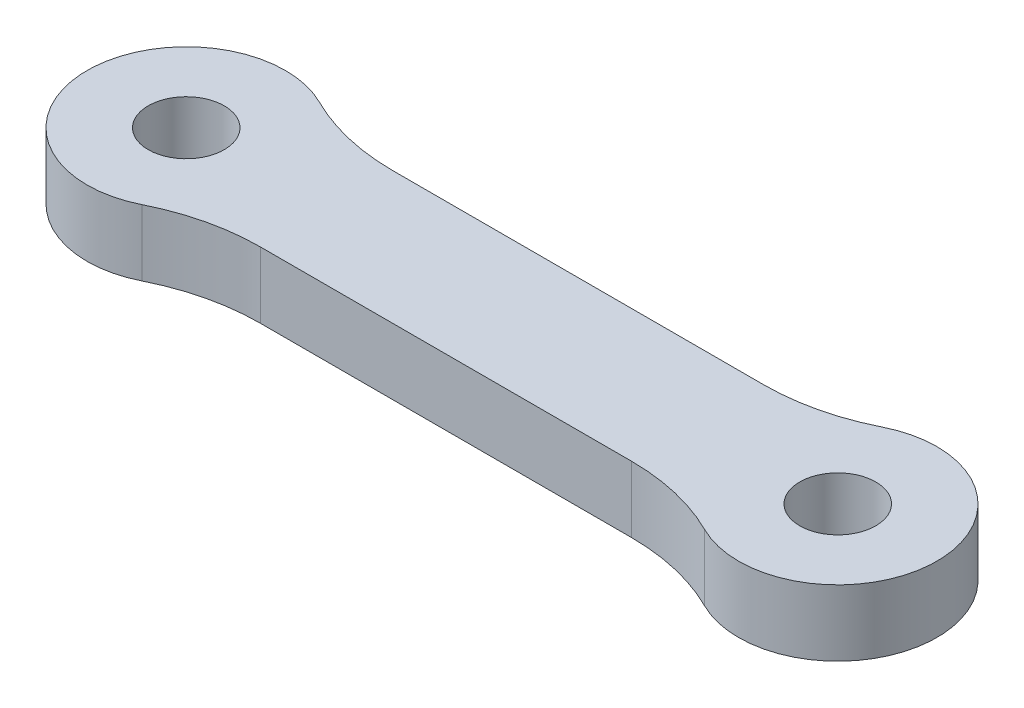
from build123d import *

# Parameters (mm, degrees)
SKETCH_1_R      = 1.15
EXTRUDE_1_DEPTH = 2
FILLET_1_R      = 6.5


with BuildPart() as part:
    # Эскиз1 → Бобышка-Вытянуть1 (new body)
    with BuildSketch(Plane(origin=(0, 0, 0), x_dir=(1, 0, 0), z_dir=(0, 1, 0))):
        with BuildLine():
            Line((2.236067977, 2), (17.463932023, 2))
            ThreePointArc((17.463932023, 2), (22.7, 0), (17.463932023, -2))
            Line((17.463932023, -2), (2.236067977, -2))
            ThreePointArc((2.236067977, -2), (-3, 0), (2.236067977, 2))
        make_face()
        with Locations(Location((0, 0, 0), (0, 0, 270))):
            Circle(SKETCH_1_R, mode=Mode.SUBTRACT)
        with Locations(Location((19.7, 0, 0), (0, 0, 270))):
            Circle(SKETCH_1_R, mode=Mode.SUBTRACT)
    extrude(amount=EXTRUDE_1_DEPTH)

    # Скругление1
    fillet_1_edges = [part.edges().sort_by_distance(p)[0] for p in [
        (2.236067977, 1, 2),
        (2.236067977, 1, -2),
        (17.463932023, 1, -2),
        (17.463932023, 1, 2),
    ]]
    fillet(fillet_1_edges, radius=FILLET_1_R)


solid = part.part
